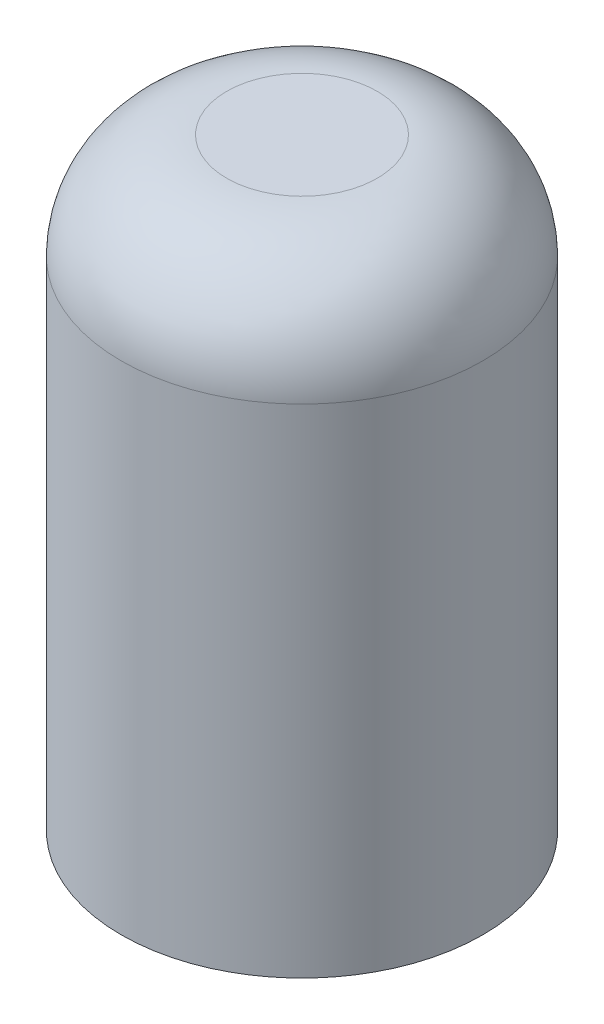
from build123d import *

# Parameters (mm, degrees)
SHELL4_T = -2


with BuildPart() as part:
    # Sketch1 → Revolve4 (revolve)
    with BuildSketch(Plane.XY, mode=Mode.PRIVATE) as revolve4_sk:
        with BuildLine():
            Line((0, 0), (60, 0))
            Line((60, 0), (60, 165))
            ThreePointArc((60, 165), (49.748737342, 189.748737342), (25, 200))
            Line((25, 200), (0, 200))
            Line((0, 200), (0, 0))
        make_face()
    revolve(revolve4_sk.sketch.rotate(Axis((0, 200, 0), (0, -1, 0)), 180), axis=Axis((0, 200, 0), (0, -1, 0)))

    # Shell4
    shell4_openings = [part.faces().sort_by_distance(p)[0] for p in [
        (0, 0, 0),
    ]]
    offset(amount=SHELL4_T, openings=shell4_openings, kind=Kind.INTERSECTION)


solid = part.part
